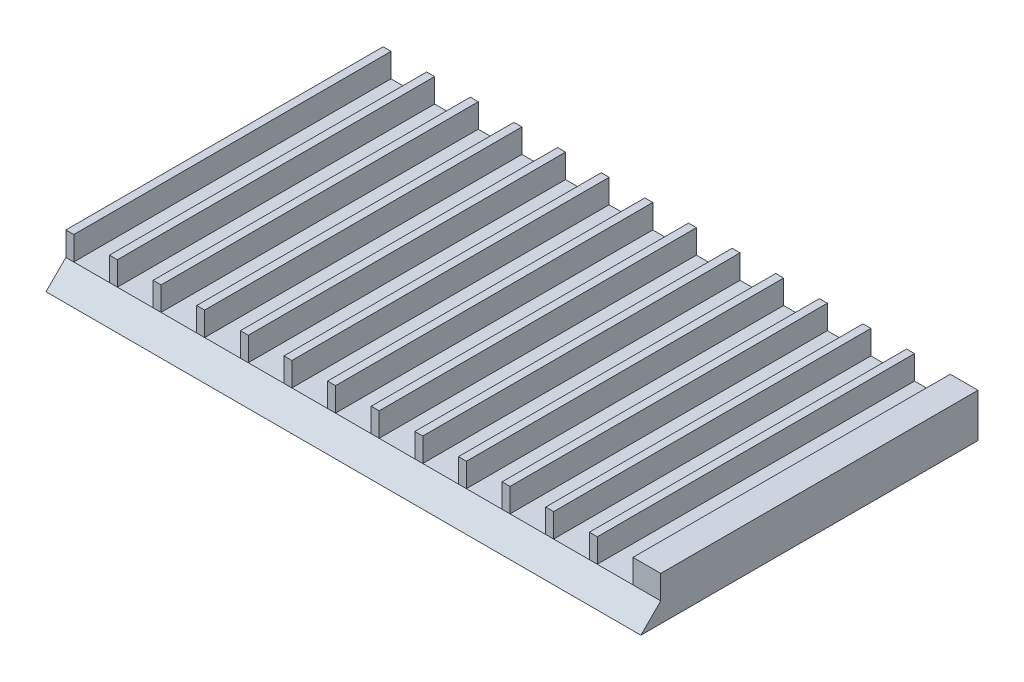
from build123d import *

# Parameters (mm, degrees)
SKETCH1_W           = 150
SKETCH1_H           = 80
BOSS_EXTRUDE1_DEPTH = 5
SKETCH2_W           = 2
SKETCH2_H           = 80
SKETCH2_W_2         = 7
BOSS_EXTRUDE2_DEPTH = 6
BOSS_EXTRUDE3_REACH = 172.356


with BuildPart() as part:
    # Sketch1 → Boss-Extrude1 (new body)
    with BuildSketch(Plane(origin=(0, 0, 0), x_dir=(1, 0, 0), z_dir=(0, 1, 0))):
        with Locations((75, 40)):
            Rectangle(SKETCH1_W, SKETCH1_H)
    extrude(amount=BOSS_EXTRUDE1_DEPTH)

    # Sketch2 → Boss-Extrude2 (add)
    with BuildSketch(Plane(origin=(0, 5, 0), x_dir=(1, 0, 0), z_dir=(0, 1, 0))):
        with Locations((1, 40)):
            Rectangle(SKETCH2_W, SKETCH2_H)
        with Locations((12, 40)):
            Rectangle(SKETCH2_W, SKETCH2_H)
        with Locations((23, 40)):
            Rectangle(SKETCH2_W, SKETCH2_H)
        with Locations((34, 40)):
            Rectangle(SKETCH2_W, SKETCH2_H)
        with Locations((45, 40)):
            Rectangle(SKETCH2_W, SKETCH2_H)
        with Locations((56, 40)):
            Rectangle(SKETCH2_W, SKETCH2_H)
        with Locations((67, 40)):
            Rectangle(SKETCH2_W, SKETCH2_H)
        with Locations((78, 40)):
            Rectangle(SKETCH2_W, SKETCH2_H)
        with Locations((89, 40)):
            Rectangle(SKETCH2_W, SKETCH2_H)
        with Locations((100, 40)):
            Rectangle(SKETCH2_W, SKETCH2_H)
        with Locations((111, 40)):
            Rectangle(SKETCH2_W, SKETCH2_H)
        with Locations((122, 40)):
            Rectangle(SKETCH2_W, SKETCH2_H)
        with Locations((133, 40)):
            Rectangle(SKETCH2_W, SKETCH2_H)
        with Locations((146.5, 40)):
            Rectangle(SKETCH2_W_2, SKETCH2_H)
    extrude(amount=BOSS_EXTRUDE2_DEPTH)

    # Boss-Extrude3: up to this face of the body (flat: up to its plane)
    boss_extrude3_end = Plane(part.part.faces().sort_by_distance((150, 5.5, -40))[0])
    # Sketch3 → Boss-Extrude3 (add, up to the picked face)
    with BuildSketch(Plane.ZY, mode=Mode.PRIVATE) as boss_extrude3_sk1:
        Polygon((0, 0), (0, 5), (5, 0), align=None)
    boss_extrude3_tool1 = split(extrude(boss_extrude3_sk1.sketch, amount=-BOSS_EXTRUDE3_REACH, mode=Mode.PRIVATE), bisect_by=boss_extrude3_end, keep=Keep.BOTH, mode=Mode.PRIVATE)
    add(boss_extrude3_tool1.solids().sort_by(Axis((0, 1.666667, 1.666667), (1, 0, 0)))[0])


solid = part.part
